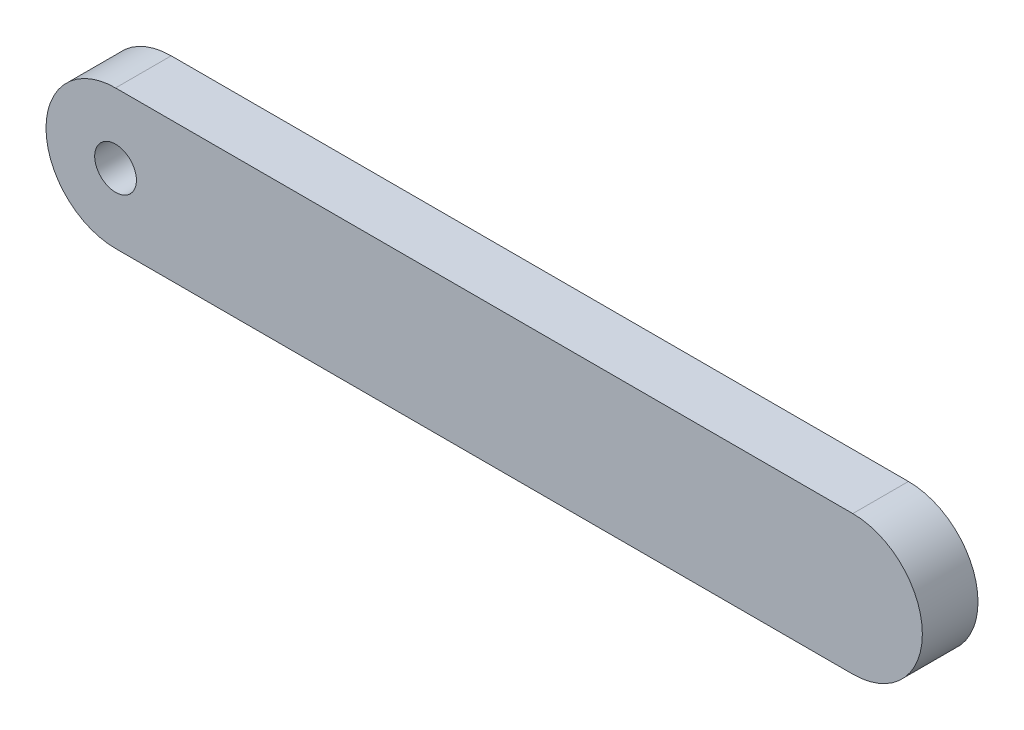
from build123d import *

# Parameters (mm, degrees)
SKETCH1_R           = 1.5
BOSS_EXTRUDE1_DEPTH = 4


with BuildPart() as part:
    # Sketch1 → Boss-Extrude1 (new body)
    with BuildSketch(Plane.XY):
        with BuildLine():
            Line((0, 5), (53, 5))
            ThreePointArc((53, 5), (58, 0), (53, -5))
            Line((53, -5), (0, -5))
            ThreePointArc((0, -5), (-5, 0), (0, 5))
        make_face()
        Circle(SKETCH1_R, mode=Mode.SUBTRACT)
    extrude(amount=BOSS_EXTRUDE1_DEPTH)


solid = part.part
